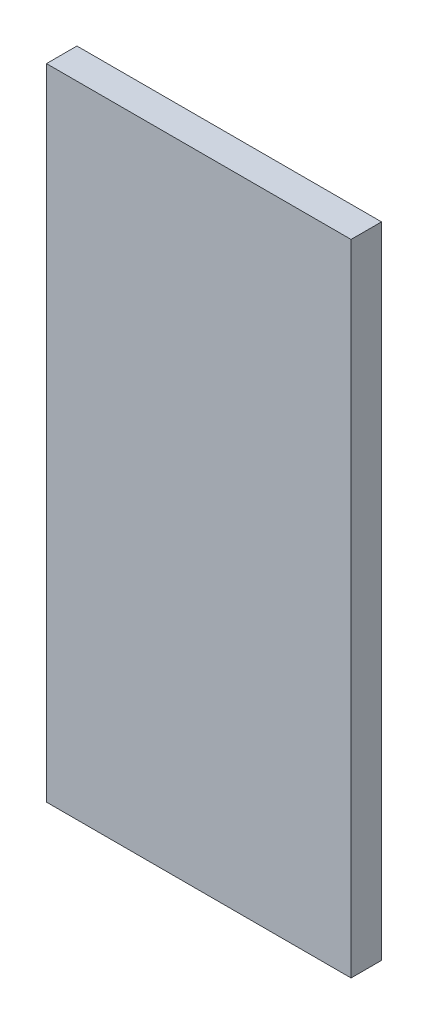
from build123d import *

# Parameters (mm, degrees)
SKETCH1_W           = 100
SKETCH1_H           = 210
BOSS_EXTRUDE1_DEPTH = 10


with BuildPart() as part:
    # Sketch1 → Boss-Extrude1 (new body)
    with BuildSketch(Plane.XY):
        with Locations((50, 105)):
            Rectangle(SKETCH1_W, SKETCH1_H)
    extrude(amount=BOSS_EXTRUDE1_DEPTH)


solid = part.part
